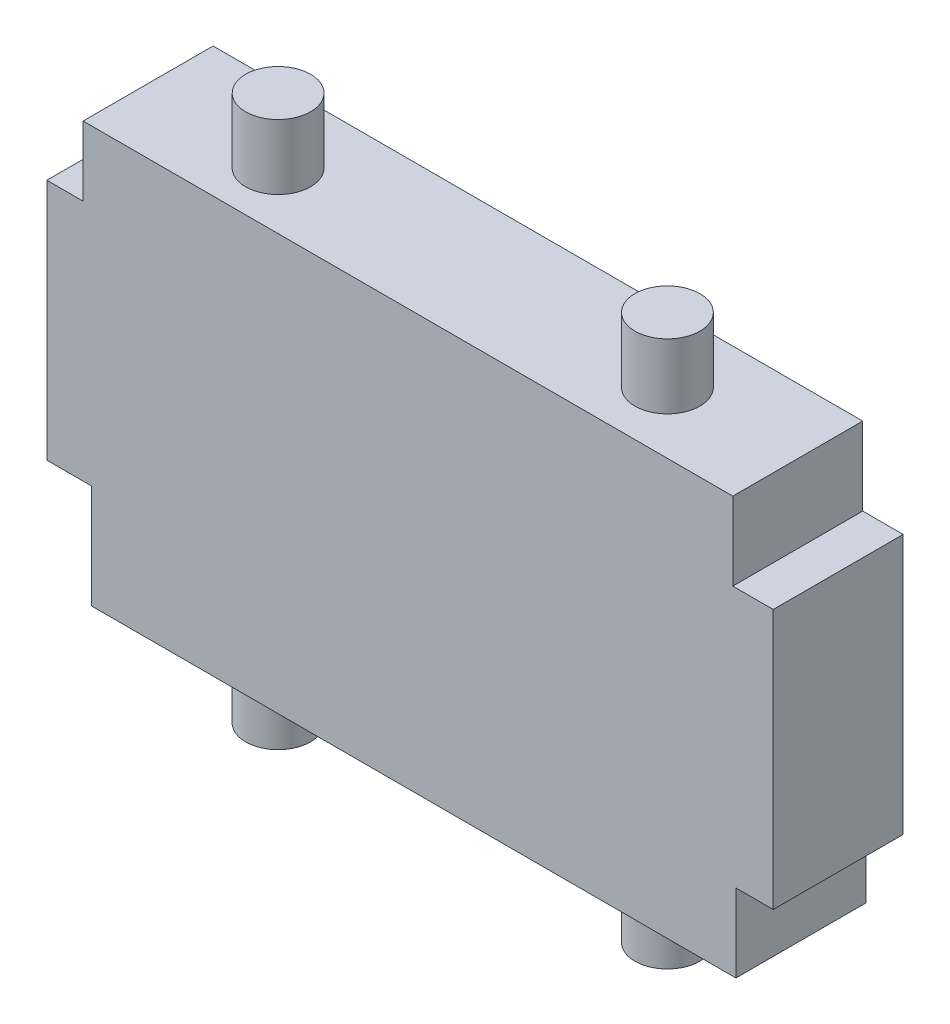
from build123d import *

# Parameters (mm, degrees)
BOSS_EXTRUDE1_DEPTH = 25.4
SKETCH4_R           = 6.35
BOSS_EXTRUDE2_DEPTH = 12.7
BOSS_EXTRUDE3_START = 12.7
SKETCH2_R           = 6.35
BOSS_EXTRUDE3_DEPTH = 12.7


with BuildPart() as part:
    # Sketch1 → Boss-Extrude1 (new body)
    with BuildSketch(Plane.XY):
        Polygon((-77.172248804, 33.927432217), (49.827751196, 33.927432217), (49.827751196, 18.687432217), (57.727272727, 18.687432217), (57.727272727, -32.112567783), (50.435406699, -32.112567783), (50.435406699, -47.352567783), (-75.551834131, -47.352567783), (-75.551834131, -27.040669856), (-84.261562998, -27.040669856), (-84.261562998, 20.35645933), (-77.172248804, 20.35645933), align=None)
    extrude(amount=BOSS_EXTRUDE1_DEPTH)

    # Sketch4 → Boss-Extrude2 (add)
    with BuildSketch(Plane(origin=(0, 33.927432217, 0), x_dir=(1, 0, 0), z_dir=(0, 1, 0))):
        with Locations(Location((-50.151834131, -14.306606111, 0), (0, 0, 270))):
            Circle(SKETCH4_R)
        with Locations(Location((25.035406699, -13.388545476, 0), (0, 0, 270))):
            Circle(SKETCH4_R)
    extrude(amount=BOSS_EXTRUDE2_DEPTH)

    # Sketch2 → Boss-Extrude3 (add)
    with BuildSketch(Plane.XZ.offset(47.352567783).offset(BOSS_EXTRUDE3_START)):
        with Locations(Location((-50.151834131, 14.306606111, 0), (0, 0, 90))):
            Circle(SKETCH2_R)
        with Locations(Location((25.035406699, 13.388545476, 0), (0, 0, 90))):
            Circle(SKETCH2_R)
    extrude(amount=-BOSS_EXTRUDE3_DEPTH)


solid = part.part
